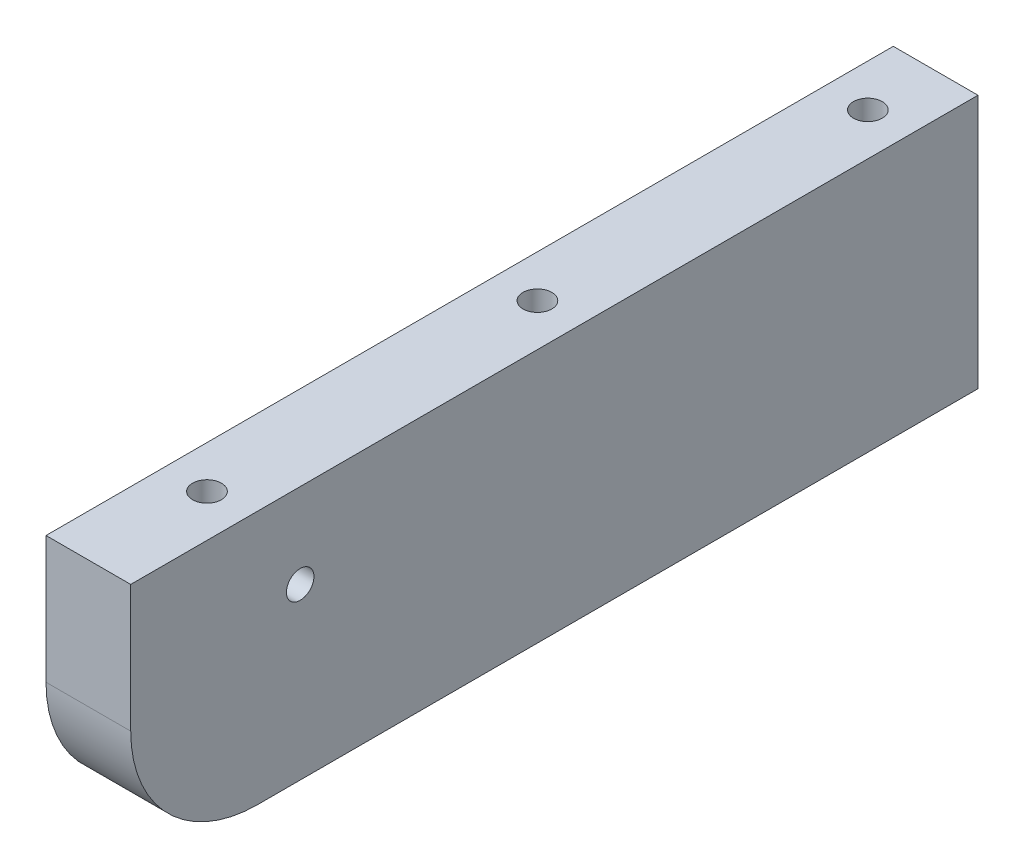
from build123d import *

# Parameters (mm, degrees)
SKETCH1_W                     = 100
SKETCH1_H                     = 30
SKETCH1_R                     = 1.625
BOSS_EXTRUDE1_DEPTH           = 10
FILLET1_R                     = 15
CBORE_FOR_M3_SHCS_D           = 3.4
CBORE_FOR_M3_SHCS_DEPTH       = 23
CBORE_FOR_M3_SHCS_CBORE_D     = 6.5
CBORE_FOR_M3_SHCS_CBORE_DEPTH = 3
CBORE_FOR_M3_SHCS_TIP         = 1.021463052


with BuildPart() as part:
    # Sketch1 → Boss-Extrude1 (new body)
    with BuildSketch(Plane(origin=(0, 0, 0), x_dir=(0, 0, -1), z_dir=(1, 0, 0))):
        Rectangle(SKETCH1_W, SKETCH1_H)
        with Locations((-30, 5)):
            Circle(SKETCH1_R, mode=Mode.SUBTRACT)
    extrude(amount=BOSS_EXTRUDE1_DEPTH)

    # Fillet1
    fillet1_edges = [part.edges().sort_by_distance(p)[0] for p in [
        (5, -15, 50),
    ]]
    fillet(fillet1_edges, radius=FILLET1_R)

    # CBORE for M3 SHCS
    with Locations(Plane(origin=(-726.293536786, 25, -1323.282701689), x_dir=(1, 0, 0), z_dir=(0, 1, 0))):
        with Locations((731.293536786, -1281.282701689), (731.293536786, -1359.282701689), (621.293536786, -1281.282701689), (621.293536786, -1365.282701689), (621.293536786, -1323.282701689), (731.293536786, -1320.282701689)):
            CounterBoreHole(CBORE_FOR_M3_SHCS_D / 2, CBORE_FOR_M3_SHCS_CBORE_D / 2, CBORE_FOR_M3_SHCS_CBORE_DEPTH, depth=CBORE_FOR_M3_SHCS_DEPTH)
            with Locations((0, 0, -(CBORE_FOR_M3_SHCS_DEPTH + CBORE_FOR_M3_SHCS_TIP / 2))):  # 118° drill point
                Cone(0, CBORE_FOR_M3_SHCS_D / 2, CBORE_FOR_M3_SHCS_TIP, mode=Mode.SUBTRACT)


solid = part.part
